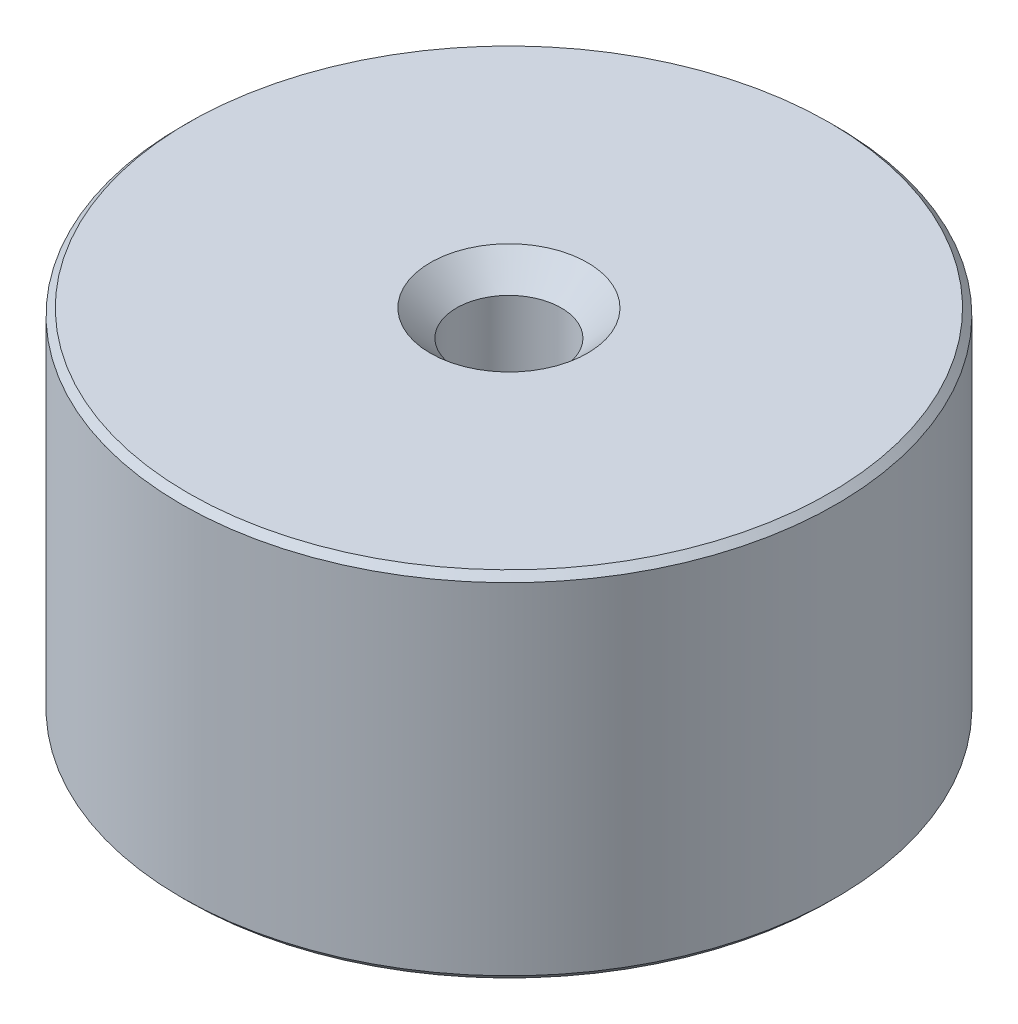
from build123d import *

# Parameters (mm, degrees)
SKETCH_1_R          = 25
EXTRUDE_1_DEPTH     = 27
SKETCH_9_R          = 4
CUT_EXTRUDE_1_DEPTH = 12
CHAMFER_1_SIZE      = 2
CHAMFER_2_SIZE      = 0.5
SKETCH_11_R         = 18
SKETCH_11_R_2       = 11
CUT_EXTRUDE_2_DEPTH = 2
CHAMFER_3_SIZE      = 0.5


with BuildPart() as part:
    # 草图1 → 凸台-拉伸1 (new body)
    with BuildSketch(Plane(origin=(0, 0, 0), x_dir=(1, 0, 0), z_dir=(0, 1, 0))):
        with Locations(Location((0, 0, 0), (0, 0, 270))):
            Circle(SKETCH_1_R)
    extrude(amount=EXTRUDE_1_DEPTH)

    # 草图9 → 切除-拉伸1 (cut)
    with BuildSketch(Plane(origin=(0, 27, 0), x_dir=(1, 0, 0), z_dir=(0, 1, 0))):
        with Locations(Location((0, 0, 0), (0, 0, 270))):
            Circle(SKETCH_9_R)
    extrude(amount=-CUT_EXTRUDE_1_DEPTH, mode=Mode.SUBTRACT)

    # 草图10 → 切除-旋转2 (revolve, cut)
    with BuildSketch(Plane.XY, mode=Mode.PRIVATE) as cut_revolve_2_sk:
        Polygon((-4, 15), (0, 12.093829888), (0, 15), align=None)
    revolve(cut_revolve_2_sk.sketch.rotate(Axis((0, 12.093829888, 0), (0, 1, 0)), 90), axis=Axis((0, 12.093829888, 0), (0, 1, 0)), mode=Mode.SUBTRACT)

    # 倒角1
    chamfer_1_edges = [part.edges().sort_by_distance(p)[0] for p in [
        (0, 27, -4),
    ]]
    chamfer(chamfer_1_edges, length=CHAMFER_1_SIZE)

    # 倒角2
    chamfer_2_edges = [part.edges().sort_by_distance(p)[0] for p in [
        (0, 0, -25),
        (0, 27, -25),
    ]]
    chamfer(chamfer_2_edges, length=CHAMFER_2_SIZE)

    # 草图11 → 切除-拉伸2 (cut)
    with BuildSketch(Plane.XZ):
        with Locations(Location((0, 0, 0), (0, 0, 270))):
            Circle(SKETCH_11_R)
        with Locations(Location((0, 0, 0), (0, 0, 270))):
            Circle(SKETCH_11_R_2, mode=Mode.SUBTRACT)
    extrude(amount=-CUT_EXTRUDE_2_DEPTH, mode=Mode.SUBTRACT)

    # 倒角3
    chamfer_3_edges = [part.edges().sort_by_distance(p)[0] for p in [
        (0, 2, 11),
        (0, 0, 11),
    ]]
    chamfer(chamfer_3_edges, length=CHAMFER_3_SIZE)


solid = part.part
